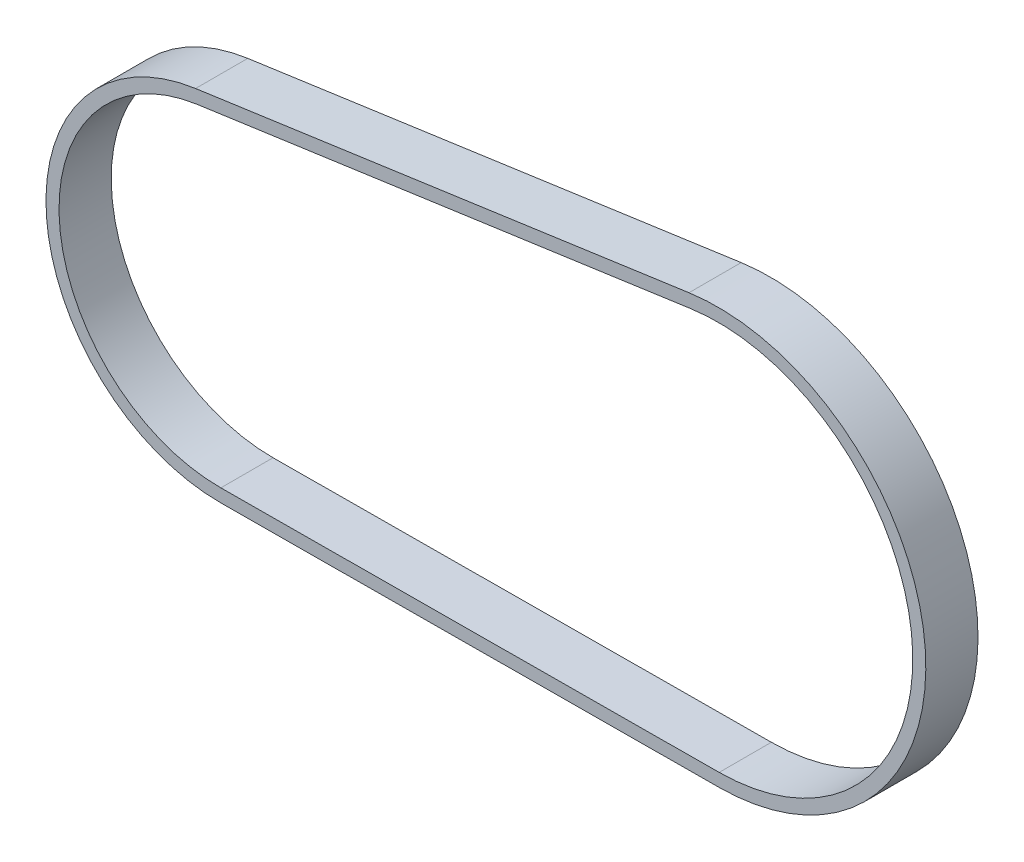
from build123d import *

# Parameters (mm, degrees)
EXTRUDE_THIN1_DEPTH = 6


with BuildPart() as part:
    # Sketch2 → Extrude-Thin1 (new body)
    with BuildSketch(Plane.XY):
        with BuildLine():
            Line((-2.803531962, 19.802530357), (53.913210544, 27.832170889))
            ThreePointArc((53.913210544, 27.832170889), (81.07234192, 5.935165477), (57.391766952, -19.68372662))
            Line((57.391766952, -19.68372662), (0.110319946, -19.999695735))
            ThreePointArc((0.110319946, -19.999695735), (-19.94661997, -1.460257437), (-2.803531962, 19.802530357))
        make_face()
        with BuildLine():
            Line((-2.593267065, 18.31734058), (54.123475441, 26.346981112))
            ThreePointArc((54.123475441, 26.346981112), (79.576345422, 5.825646169), (57.383492956, -18.18374944))
            Line((57.383492956, -18.18374944), (0.10204595, -18.499718555))
            ThreePointArc((0.10204595, -18.499718555), (-18.450623472, -1.350738129), (-2.593267065, 18.31734058))
        make_face(mode=Mode.SUBTRACT)
    extrude(amount=-EXTRUDE_THIN1_DEPTH)


solid = part.part
